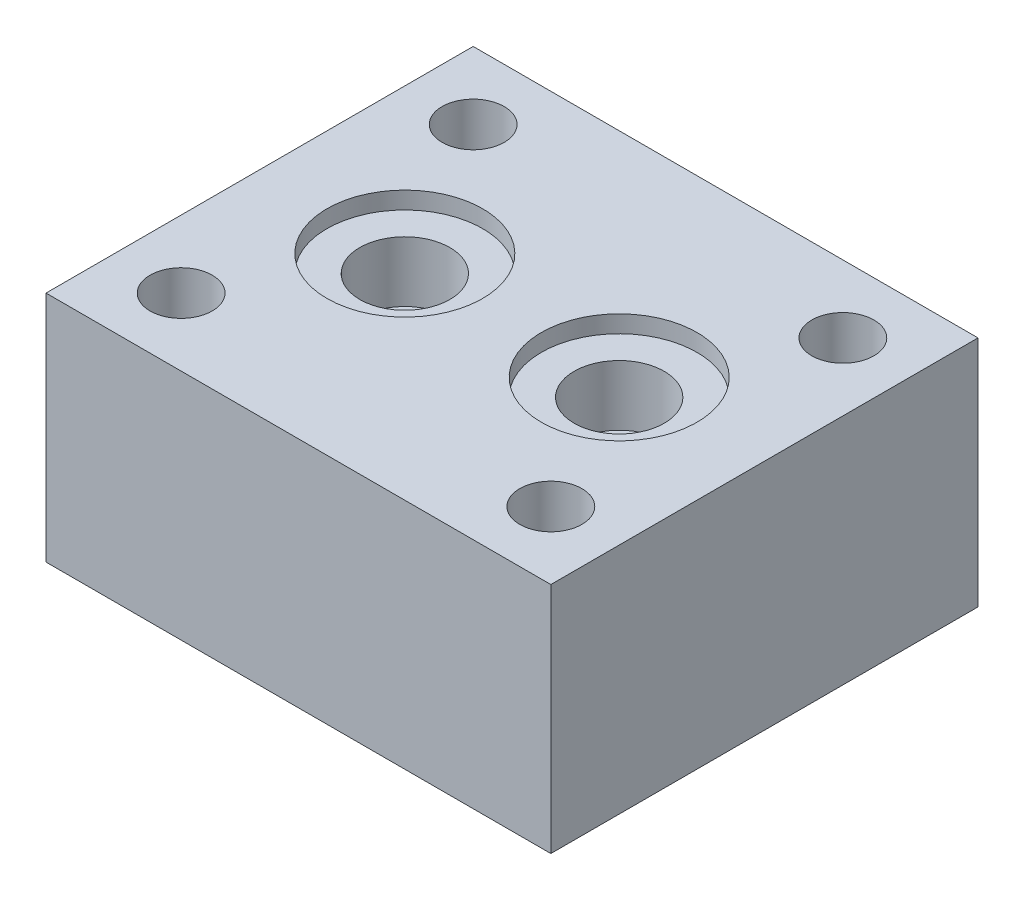
from build123d import *

# Parameters (mm, degrees)
SKETCH1_W           = 82.55
SKETCH1_H           = 69.85
BOSS_EXTRUDE1_DEPTH = 19.05
CUT_EXTRUDE2_START  = 19.05
SKETCH2_R           = 5.08
CUT_EXTRUDE2_DEPTH  = 77.376117521
CUT_EXTRUDE4_START  = 19.05
SKETCH3_R           = 7.366
CUT_EXTRUDE4_DEPTH  = 12.7
CUT_EXTRUDE6_START  = 19.05
SKETCH4_R           = 12.7254
CUT_EXTRUDE6_DEPTH  = 2.8194


with BuildPart() as part:
    # Sketch1 → Boss-Extrude1 (new, symmetric)
    with BuildSketch(Plane(origin=(0, 0, 0), x_dir=(1, 0, 0), z_dir=(0, 1, 0))):
        Rectangle(SKETCH1_W, SKETCH1_H)
    extrude(amount=BOSS_EXTRUDE1_DEPTH, both=True)

    # Sketch2 → Cut-Extrude2 (cut, through all)
    with BuildSketch(Plane(origin=(0, 0, 0), x_dir=(1, 0, 0), z_dir=(0, 1, 0)).offset(CUT_EXTRUDE2_START)):
        with Locations(Location((-30.226, -23.876, 0), (0, 0, 270))):
            Circle(SKETCH2_R)
        with Locations(Location((30.226, -23.876, 0), (0, 0, 270))):
            Circle(SKETCH2_R)
        with Locations(Location((-30.226, 23.876, 0), (0, 0, 270))):
            Circle(SKETCH2_R)
        with Locations(Location((30.226, 23.876, 0), (0, 0, 270))):
            Circle(SKETCH2_R)
    extrude(amount=-CUT_EXTRUDE2_DEPTH, mode=Mode.SUBTRACT)

    # Sketch3 → Cut-Extrude4 (cut)
    with BuildSketch(Plane(origin=(0, 0, 0), x_dir=(1, 0, 0), z_dir=(0, 1, 0)).offset(CUT_EXTRUDE4_START)):
        with Locations(Location((-17.526, 0, 0), (0, 0, 270))):
            Circle(SKETCH3_R)
        with Locations(Location((17.526, 0, 0), (0, 0, 270))):
            Circle(SKETCH3_R)
    extrude(amount=-CUT_EXTRUDE4_DEPTH, mode=Mode.SUBTRACT)

    # Sketch4 → Cut-Extrude6 (cut)
    with BuildSketch(Plane(origin=(0, 0, 0), x_dir=(1, 0, 0), z_dir=(0, 1, 0)).offset(CUT_EXTRUDE6_START)):
        with Locations(Location((-17.526, 0, 0), (0, 0, 270))):
            Circle(SKETCH4_R)
        with Locations(Location((17.526, 0, 0), (0, 0, 270))):
            Circle(SKETCH4_R)
    extrude(amount=-CUT_EXTRUDE6_DEPTH, mode=Mode.SUBTRACT)


solid = part.part
